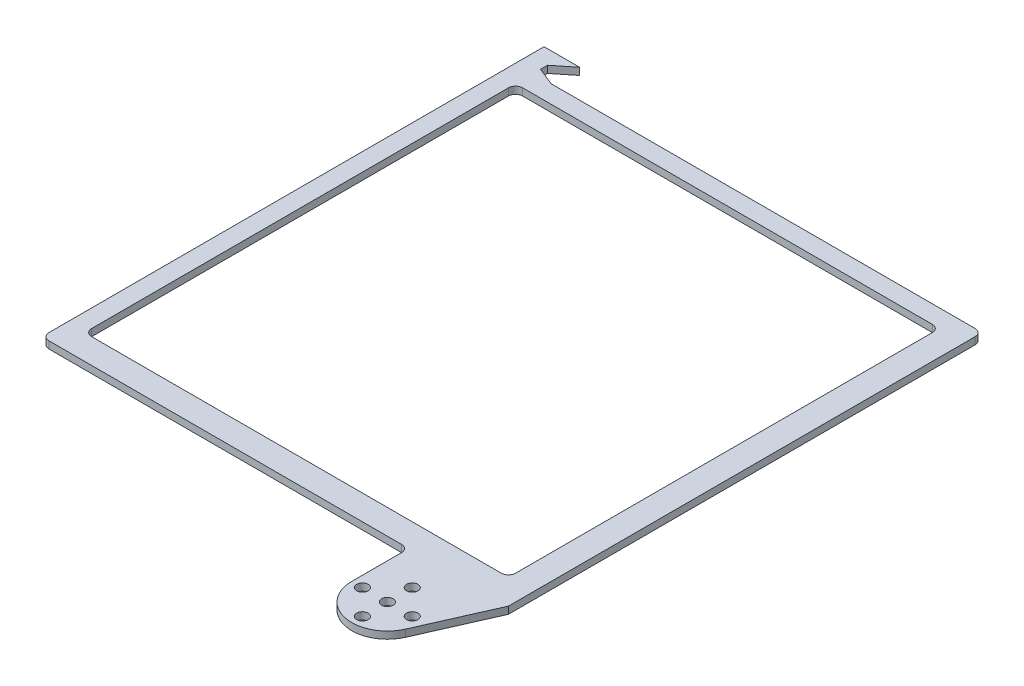
from build123d import *

# Parameters (mm, degrees)
SKETCH_1_R          = 1.6
EXTRUDE_1_DEPTH     = 2
EXTRUDE_2_DEPTH     = 2
CUT_EXTRUDE_1_DEPTH = 193.473374782
FILLET_1_R          = 2


with BuildPart() as part:
    # 草图1 → 凸台-拉伸1 (new body)
    with BuildSketch(Plane(origin=(0, 0, 0), x_dir=(1, 0, 0), z_dir=(0, 1, 0))):
        with BuildLine():
            Line((-28, -16), (-28, 0))
            Line((-28, 0), (-131, 0))
            Line((-131, 0), (-131, 133))
            Line((-131, 133), (0, 133))
            Line((0, 133), (0, 0))
            Line((0, 0), (-8.852716607, -20.040693817))
            ThreePointArc((-8.852716607, -20.040693817), (-20.064844554, -25.78449881), (-28, -16))
        make_face()
        with Locations(Location((-18, -9, 0), (0, 0, 270))):
            Circle(SKETCH_1_R, mode=Mode.SUBTRACT)
        with Locations(Location((-11, -16, 0), (0, 0, 270))):
            Circle(SKETCH_1_R, mode=Mode.SUBTRACT)
        with Locations(Location((-18, -23, 0), (0, 0, 270))):
            Circle(SKETCH_1_R, mode=Mode.SUBTRACT)
        with Locations(Location((-25, -16, 0), (0, 0, 270))):
            Circle(SKETCH_1_R, mode=Mode.SUBTRACT)
        with Locations(Location((-18, -16, 0), (0, 0, 270))):
            Circle(SKETCH_1_R, mode=Mode.SUBTRACT)
    extrude(amount=EXTRUDE_1_DEPTH)

    # 草图2 → 凸台-拉伸2 (add)
    with BuildSketch(Plane(origin=(0, 2, 0), x_dir=(1, 0, 0), z_dir=(0, 1, 0))):
        Polygon((-131, 133), (-131, 141), (-121, 141), (-126, 137), (-126, 135), (-121, 133), align=None)
    extrude(amount=-EXTRUDE_2_DEPTH)

    # 草图3 → 切除-拉伸1 (cut, through all)
    with BuildSketch(Plane(origin=(0, 2, 0), x_dir=(1, 0, 0), z_dir=(0, 1, 0))):
        with BuildLine():
            Line((-124, 128), (-9, 128))
            ThreePointArc((-9, 128), (-7.585786438, 127.414213562), (-7, 126))
            Line((-7, 126), (-7, 9))
            ThreePointArc((-7, 9), (-7.585786438, 7.585786438), (-9, 7))
            Line((-9, 7), (-124, 7))
            ThreePointArc((-124, 7), (-125.414213562, 7.585786438), (-126, 9))
            Line((-126, 9), (-126, 126))
            ThreePointArc((-126, 126), (-125.414213562, 127.414213562), (-124, 128))
        make_face()
    extrude(amount=-CUT_EXTRUDE_1_DEPTH, mode=Mode.SUBTRACT)

    # 圆角1
    fillet_1_edges = [part.edges().sort_by_distance(p)[0] for p in [
        (-28, 1, 0),
        (-131, 1, 0),
        (0, 1, -133),
    ]]
    fillet(fillet_1_edges, radius=FILLET_1_R)


solid = part.part
